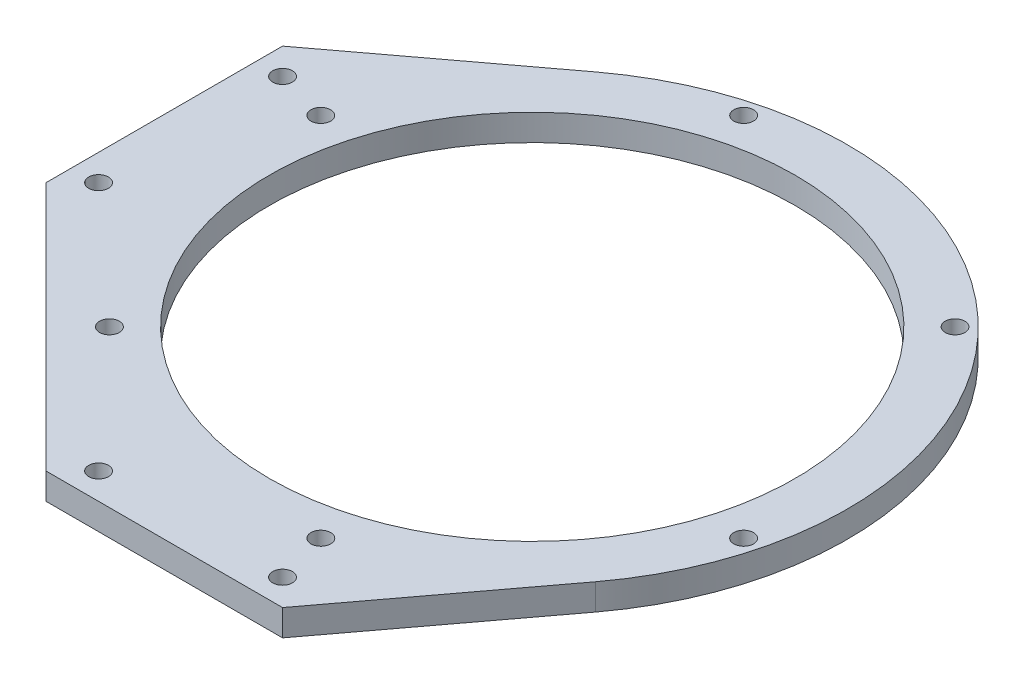
from build123d import *

# Parameters (mm, degrees)
SKETCH_1_R      = 40
SKETCH_1_R_2    = 1.5
EXTRUDE_1_DEPTH = 4


with BuildPart() as part:
    # 草图1 → 凸台-拉伸1 (new body)
    with BuildSketch(Plane(origin=(0, 0, 0), x_dir=(1, 0, 0), z_dir=(0, 1, 0))):
        with BuildLine():
            Line((-56, 18), (-56, -18))
            Line((-56, -18), (-18, -56))
            Line((-18, -56), (18, -56))
            Line((18, -56), (38.4, -28.8))
            ThreePointArc((38.4, -28.8), (33.941125497, 33.941125497), (-28.8, 38.4))
            Line((-28.8, 38.4), (-56, 18))
        make_face()
        with Locations(Location((0, 0, 0), (0, 0, 270))):
            Circle(SKETCH_1_R, mode=Mode.SUBTRACT)
        with Locations(Location((32.173358544, 32.173358544, 0), (0, 0, 270))):
            Circle(SKETCH_1_R_2, mode=Mode.SUBTRACT)
        with Locations(Location((43.949625096, -11.776266552, 0), (0, 0, 270))):
            Circle(SKETCH_1_R_2, mode=Mode.SUBTRACT)
        with Locations(Location((11.776266552, -43.949625096, 0), (0, 0, 270))):
            Circle(SKETCH_1_R_2, mode=Mode.SUBTRACT)
        with Locations(Location((-32.173358544, -32.173358544, 0), (0, 0, 270))):
            Circle(SKETCH_1_R_2, mode=Mode.SUBTRACT)
        with Locations(Location((-43.949625096, 11.776266552, 0), (0, 0, 270))):
            Circle(SKETCH_1_R_2, mode=Mode.SUBTRACT)
        with Locations(Location((-11.776266552, 43.949625096, 0), (0, 0, 270))):
            Circle(SKETCH_1_R_2, mode=Mode.SUBTRACT)
        with Locations(Location((-14, -52, 0), (0, 0, 270))):
            Circle(SKETCH_1_R_2, mode=Mode.SUBTRACT)
        with Locations(Location((14, -52, 0), (0, 0, 90))):
            Circle(SKETCH_1_R_2, mode=Mode.SUBTRACT)
        with Locations(Location((-52, -14, 0), (0, 0, 90))):
            Circle(SKETCH_1_R_2, mode=Mode.SUBTRACT)
        with Locations(Location((-52, 14, 0), (0, 0, 270))):
            Circle(SKETCH_1_R_2, mode=Mode.SUBTRACT)
    extrude(amount=EXTRUDE_1_DEPTH)


solid = part.part
